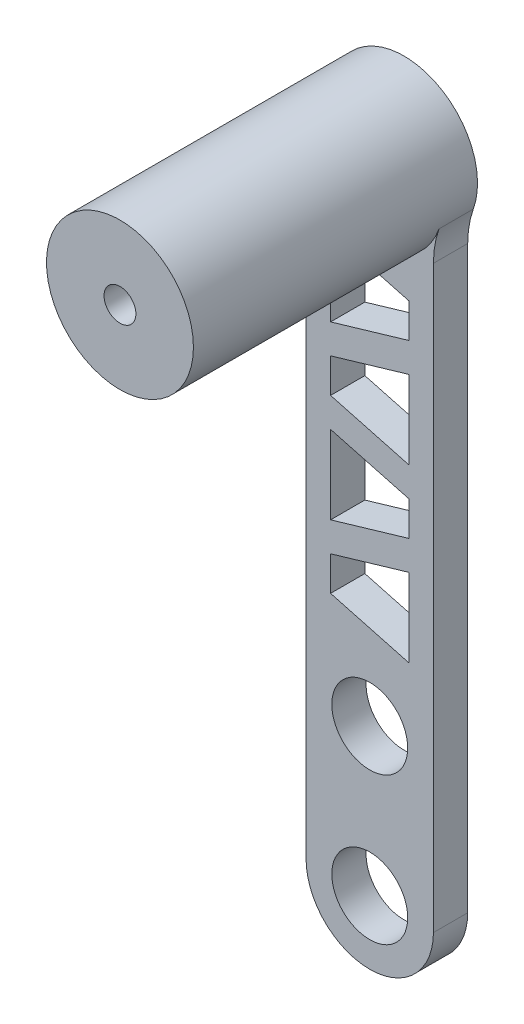
from build123d import *

# Parameters (mm, degrees)
SKETCH1_R           = 7.75
BOSS_EXTRUDE1_DEPTH = 7
SKETCH2_R           = 15
SKETCH2_R_2         = 3.25
BOSS_EXTRUDE2_DEPTH = 51


with BuildPart() as part:
    # Sketch1 → Boss-Extrude1 (new body)
    with BuildSketch(Plane.XY):
        with BuildLine():
            Line((-14.121781939, 65.817369233), (-14.121781939, -52.520726978))
            ThreePointArc((-14.121781939, -52.520726978), (-1.121781939, -65.520726978), (11.878218061, -52.520726978))
            Line((11.878218061, -52.520726978), (11.878218061, 65.817369233))
            ThreePointArc((11.878218061, 65.817369233), (12.166002849, 69.197986251), (13.021075204, 72.481314255))
            ThreePointArc((13.021075204, 72.481314255), (-1.121781939, 92.479273022), (-15.264639082, 72.481314255))
            ThreePointArc((-15.264639082, 72.481314255), (-14.409566727, 69.197986251), (-14.121781939, 65.817369233))
        make_face()
        with Locations((-1.121781939, -52.520726978)):
            Circle(SKETCH1_R, mode=Mode.SUBTRACT)
        with Locations((-1.121781939, -22.520726978)):
            Circle(SKETCH1_R, mode=Mode.SUBTRACT)
        with Locations((-1.121781939, 77.479273022)):
            Circle(SKETCH1_R, mode=Mode.SUBTRACT)
        Polygon((-9.121781939, 3.957653989), (-9.121781939, -3.042346011), (6.878218061, -7.32953309), (6.878218061, 8.67046691), align=None, mode=Mode.SUBTRACT)
        Polygon((-9.121781939, 31.957653989), (6.878218061, 27.67046691), (6.878218061, 43.67046691), (-9.121781939, 38.957653989), align=None, mode=Mode.SUBTRACT)
        Polygon((6.878218061, 56.67046691), (-9.121781939, 60.957653989), (-9.121781939, 44.957653989), (6.878218061, 49.67046691), align=None, mode=Mode.SUBTRACT)
        Polygon((-9.121781939, 9.957653989), (6.878218061, 14.67046691), (6.878218061, 21.67046691), (-9.121781939, 25.957653989), align=None, mode=Mode.SUBTRACT)
    extrude(amount=BOSS_EXTRUDE1_DEPTH)

    # Sketch2 → Boss-Extrude2 (add)
    with BuildSketch(Plane.XY.offset(7)):
        with Locations(Location((-1.121781939, 77.479273022, 0), (0, 0, 199.462950946))):
            Circle(SKETCH2_R)
        with Locations((-1.121781939, 77.479273022)):
            Circle(SKETCH2_R_2, mode=Mode.SUBTRACT)
    extrude(amount=BOSS_EXTRUDE2_DEPTH)


solid = part.part
